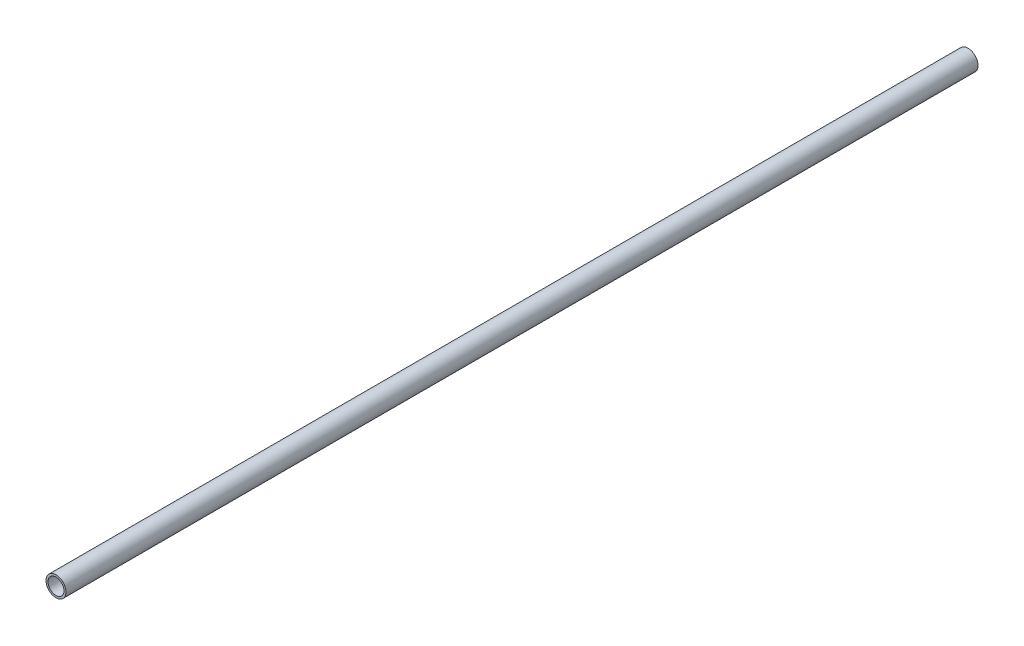
from build123d import *

# Parameters (mm, degrees)
SKETCH1_R           = 9.525
SKETCH1_R_2         = 7.62
BOSS_EXTRUDE1_DEPTH = 869.696


with BuildPart() as part:
    # Sketch1 → Boss-Extrude1 (new body)
    with BuildSketch(Plane.XY):
        with Locations((-157.890177281, 194.270649183)):
            Circle(SKETCH1_R)
        with Locations((-157.890177281, 194.270649183)):
            Circle(SKETCH1_R_2, mode=Mode.SUBTRACT)
    extrude(amount=BOSS_EXTRUDE1_DEPTH)


solid = part.part
